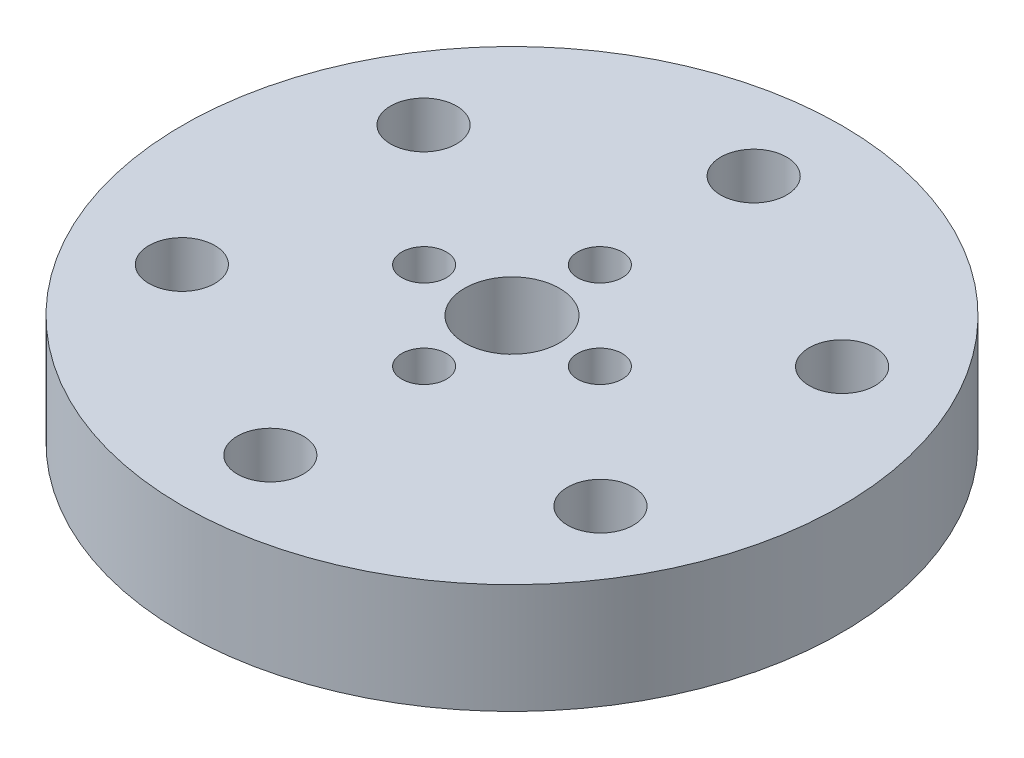
from build123d import *

# Parameters (mm, degrees)
SKETCH1_R           = 30
BOSS_EXTRUDE1_DEPTH = 10
SKETCH2_R           = 3
CUT_EXTRUDE1_DEPTH  = 10
SKETCH4_R           = 4.318
SKETCH4_R_2         = 2.032
CUT_EXTRUDE2_DEPTH  = 10


with BuildPart() as part:
    # Sketch1 → Boss-Extrude1 (new body)
    with BuildSketch(Plane(origin=(0, 0, 0), x_dir=(1, 0, 0), z_dir=(0, 1, 0))):
        with Locations(Location((0, 0, 0), (0, 0, 270))):
            Circle(SKETCH1_R)
    extrude(amount=BOSS_EXTRUDE1_DEPTH)

    # Sketch2 → Cut-Extrude1 (cut)
    with BuildSketch(Plane(origin=(0, 10, 0), x_dir=(1, 0, 0), z_dir=(0, 1, 0))):
        with Locations(Location((0, -22, 0), (0, 0, 270))):
            Circle(SKETCH2_R)
        with Locations(Location((-19.052558883, -11, 0), (0, 0, 270))):
            Circle(SKETCH2_R)
        with Locations(Location((-19.052558883, 11, 0), (0, 0, 270))):
            Circle(SKETCH2_R)
        with Locations(Location((0, 22, 0), (0, 0, 270))):
            Circle(SKETCH2_R)
        with Locations(Location((19.052558883, 11, 0), (0, 0, 270))):
            Circle(SKETCH2_R)
        with Locations(Location((19.052558883, -11, 0), (0, 0, 270))):
            Circle(SKETCH2_R)
    extrude(amount=-CUT_EXTRUDE1_DEPTH, mode=Mode.SUBTRACT)

    # Sketch4 → Cut-Extrude2 (cut)
    with BuildSketch(Plane(origin=(0, 10, 0), x_dir=(1, 0, 0), z_dir=(0, 1, 0))):
        with Locations(Location((0, 0, 0), (0, 0, 270))):
            Circle(SKETCH4_R)
        with Locations(Location((0, -8.001, 0), (0, 0, 270))):
            Circle(SKETCH4_R_2)
        with Locations(Location((-8.001, 0, 0), (0, 0, 270))):
            Circle(SKETCH4_R_2)
        with Locations(Location((0, 8.001, 0), (0, 0, 270))):
            Circle(SKETCH4_R_2)
        with Locations(Location((8.001, 0, 0), (0, 0, 270))):
            Circle(SKETCH4_R_2)
    extrude(amount=-CUT_EXTRUDE2_DEPTH, mode=Mode.SUBTRACT)


solid = part.part
